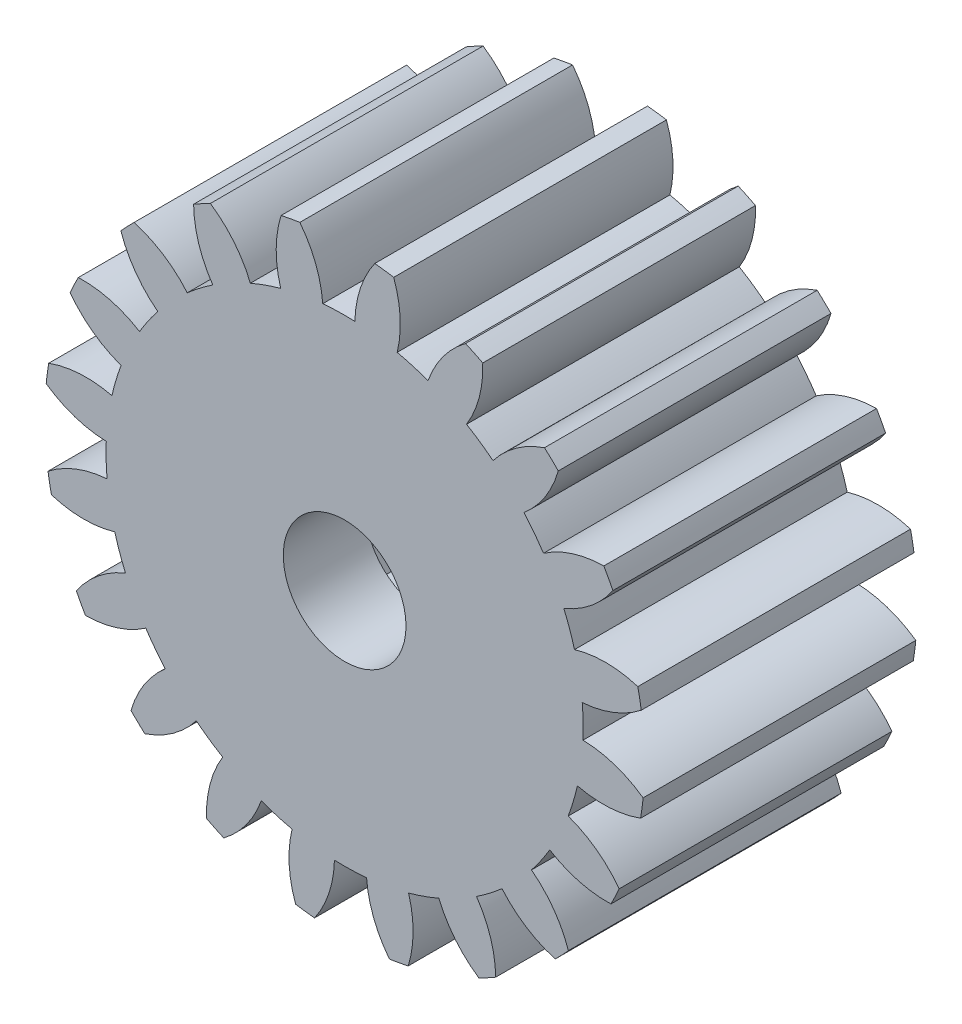
from build123d import *

# Parameters (mm, degrees)
SKETCH1_R           = 2.25
BOSS_EXTRUDE1_DEPTH = 10
CUT_EXTRUDE1_DEPTH  = 7


with BuildPart() as part:
    # Sketch1 → Boss-Extrude1 (new body)
    with BuildSketch(Plane.XY):
        with BuildLine():
            ThreePointArc((-30.571614903, -61.443860954), (-29.524113514, -61.972609686), (-28.368252904, -62.174650848))
            ThreePointArc((-28.368252904, -62.174650848), (-28.373609105, -62.764315084), (-28.339231944, -63.353000748))
            ThreePointArc((-28.339231944, -63.353000748), (-29.483745303, -63.611696612), (-30.503947952, -64.19136974))
            ThreePointArc((-30.503947952, -64.19136974), (-30.446172213, -64.536660067), (-30.377437772, -64.879936957))
            ThreePointArc((-30.377437772, -64.879936957), (-29.217812407, -65.059111153), (-28.056089489, -64.894083145))
            ThreePointArc((-28.056089489, -64.894083145), (-27.878967269, -65.456542317), (-27.664358771, -66.005792526))
            ThreePointArc((-27.664358771, -66.005792526), (-28.672914241, -66.605500992), (-29.464055771, -67.472062854))
            ThreePointArc((-29.464055771, -67.472062854), (-29.302407199, -67.782599785), (-29.130958468, -68.087835397))
            ThreePointArc((-29.130958468, -68.087835397), (-27.972721336, -67.899896238), (-26.918853644, -67.383953152))
            ThreePointArc((-26.918853644, -67.383953152), (-26.57659096, -67.864149836), (-26.202758501, -68.320200154))
            ThreePointArc((-26.202758501, -68.320200154), (-26.976631645, -69.202217578), (-27.46126961, -70.270843062))
            ThreePointArc((-27.46126961, -70.270843062), (-27.211571493, -70.516229077), (-26.954191069, -70.753544823))
            ThreePointArc((-26.954191069, -70.753544823), (-25.910718491, -70.216889105), (-25.067865938, -69.400535044))
            ThreePointArc((-25.067865938, -69.400535044), (-24.593965845, -69.751464244), (-24.09750275, -70.069673287))
            ThreePointArc((-24.09750275, -70.069673287), (-24.560941474, -71.147661659), (-24.691636133, -72.313746256))
            ThreePointArc((-24.691636133, -72.313746256), (-24.378330663, -72.469961264), (-24.060212735, -72.616127025))
            ThreePointArc((-24.060212735, -72.616127025), (-23.233647078, -71.783286348), (-22.684313942, -70.746431736))
            ThreePointArc((-22.684313942, -70.746431736), (-22.125165085, -70.933742055), (-21.554668621, -71.082961306))
            ThreePointArc((-21.554668621, -71.082961306), (-21.662308312, -72.251399614), (-21.426266363, -73.400798839))
            ThreePointArc((-21.426266363, -73.400798839), (-21.080022062, -73.452551425), (-20.732306229, -73.493259479))
            ThreePointArc((-20.732306229, -73.493259479), (-20.203557497, -72.44575809), (-20.001516335, -71.289897481))
            ThreePointArc((-20.001516335, -71.289897481), (-19.411852099, -71.295253682), (-18.823166434, -71.26087652))
            ThreePointArc((-18.823166434, -71.26087652), (-18.56447057, -72.40538988), (-17.984797442, -73.425592529))
            ThreePointArc((-17.984797442, -73.425592529), (-17.639507115, -73.36781679), (-17.296230226, -73.299082349))
            ThreePointArc((-17.296230226, -73.299082349), (-17.11705603, -72.139456983), (-17.282084037, -70.977734066))
            ThreePointArc((-17.282084037, -70.977734066), (-16.719624866, -70.800611845), (-16.170374656, -70.586003347))
            ThreePointArc((-16.170374656, -70.586003347), (-15.57066619, -71.594558818), (-14.704104328, -72.385700347))
            ThreePointArc((-14.704104328, -72.385700347), (-14.393567398, -72.224051775), (-14.088331786, -72.052603044))
            ThreePointArc((-14.088331786, -72.052603044), (-14.276270944, -70.894365913), (-14.79221403, -69.840498221))
            ThreePointArc((-14.79221403, -69.840498221), (-14.312017346, -69.498235536), (-13.855967028, -69.124403077))
            ThreePointArc((-13.855967028, -69.124403077), (-12.973949604, -69.898276222), (-11.905324121, -70.382914186))
            ThreePointArc((-11.905324121, -70.382914186), (-11.659938105, -70.13321607), (-11.422622359, -69.875835646))
            ThreePointArc((-11.422622359, -69.875835646), (-11.959278077, -68.832363068), (-12.775632138, -67.989510514))
            ThreePointArc((-12.775632138, -67.989510514), (-12.424702939, -67.515610422), (-12.106493895, -67.019147327))
            ThreePointArc((-12.106493895, -67.019147327), (-11.028505523, -67.48258605), (-9.862420926, -67.61328071))
            ThreePointArc((-9.862420926, -67.61328071), (-9.706205919, -67.29997524), (-9.560040157, -66.981857312))
            ThreePointArc((-9.560040157, -66.981857312), (-10.392880835, -66.155291654), (-11.429735447, -65.605958519))
            ThreePointArc((-11.429735447, -65.605958519), (-11.242425127, -65.046809661), (-11.093205876, -64.476313197))
            ThreePointArc((-11.093205876, -64.476313197), (-9.924767569, -64.583952889), (-8.775368344, -64.347910939))
            ThreePointArc((-8.775368344, -64.347910939), (-8.723615758, -64.001666638), (-8.682907704, -63.653950805))
            ThreePointArc((-8.682907704, -63.653950805), (-9.730409092, -63.125202073), (-10.886269702, -62.923160911))
            ThreePointArc((-10.886269702, -62.923160911), (-10.880913501, -62.333496675), (-10.915290662, -61.744811011))
            ThreePointArc((-10.915290662, -61.744811011), (-9.770777303, -61.486115147), (-8.750574654, -60.906442019))
            ThreePointArc((-8.750574654, -60.906442019), (-8.808350393, -60.561151691), (-8.877084834, -60.217874802))
            ThreePointArc((-8.877084834, -60.217874802), (-10.036710199, -60.038700606), (-11.198433117, -60.203728614))
            ThreePointArc((-11.198433117, -60.203728614), (-11.375555337, -59.641269442), (-11.590163835, -59.092019232))
            ThreePointArc((-11.590163835, -59.092019232), (-10.581608365, -58.492310767), (-9.790466835, -57.625748905))
            ThreePointArc((-9.790466835, -57.625748905), (-9.952115407, -57.315211974), (-10.123564138, -57.009976362))
            ThreePointArc((-10.123564138, -57.009976362), (-11.28180127, -57.19791552), (-12.335668962, -57.713858607))
            ThreePointArc((-12.335668962, -57.713858607), (-12.677931646, -57.233661923), (-13.051764106, -56.777611605))
            ThreePointArc((-13.051764106, -56.777611605), (-12.277890961, -55.89559418), (-11.793252996, -54.826968697))
            ThreePointArc((-11.793252996, -54.826968697), (-12.042951113, -54.581582682), (-12.300331537, -54.344266935))
            ThreePointArc((-12.300331537, -54.344266935), (-13.343804115, -54.880922654), (-14.186656669, -55.697276715))
            ThreePointArc((-14.186656669, -55.697276715), (-14.660556761, -55.346347515), (-15.157019856, -55.028138471))
            ThreePointArc((-15.157019856, -55.028138471), (-14.693581132, -53.9501501), (-14.562886473, -52.784065503))
            ThreePointArc((-14.562886473, -52.784065503), (-14.876191943, -52.627850495), (-15.194309871, -52.481684734))
            ThreePointArc((-15.194309871, -52.481684734), (-16.020875528, -53.314525411), (-16.570208664, -54.351380023))
            ThreePointArc((-16.570208664, -54.351380023), (-17.129357521, -54.164069704), (-17.699853985, -54.014850452))
            ThreePointArc((-17.699853985, -54.014850452), (-17.592214294, -52.846412145), (-17.828256244, -51.69701292))
            ThreePointArc((-17.828256244, -51.69701292), (-18.174500544, -51.645260334), (-18.522216377, -51.60455228))
            ThreePointArc((-18.522216377, -51.60455228), (-19.050965109, -52.652053668), (-19.253006271, -53.807914278))
            ThreePointArc((-19.253006271, -53.807914278), (-19.842670508, -53.802558077), (-20.431356172, -53.836935239))
            ThreePointArc((-20.431356172, -53.836935239), (-20.690052036, -52.692421879), (-21.269725164, -51.67221923))
            ThreePointArc((-21.269725164, -51.67221923), (-21.615015491, -51.729994969), (-21.95829238, -51.79872941))
            ThreePointArc((-21.95829238, -51.79872941), (-22.137466577, -52.958354776), (-21.972438569, -54.120077693))
            ThreePointArc((-21.972438569, -54.120077693), (-22.53489774, -54.297199913), (-23.08414795, -54.511808411))
            ThreePointArc((-23.08414795, -54.511808411), (-23.683856416, -53.503252941), (-24.550418278, -52.712111412))
            ThreePointArc((-24.550418278, -52.712111412), (-24.860955208, -52.873759984), (-25.16619082, -53.045208714))
            ThreePointArc((-25.16619082, -53.045208714), (-24.978251662, -54.203445846), (-24.462308576, -55.257313538))
            ThreePointArc((-24.462308576, -55.257313538), (-24.94250526, -55.599576222), (-25.398555578, -55.973408682))
            ThreePointArc((-25.398555578, -55.973408682), (-26.280573002, -55.199535537), (-27.349198485, -54.714897573))
            ThreePointArc((-27.349198485, -54.714897573), (-27.594584501, -54.964595689), (-27.831900247, -55.221976113))
            ThreePointArc((-27.831900247, -55.221976113), (-27.295244529, -56.265448691), (-26.478890468, -57.108301245))
            ThreePointArc((-26.478890468, -57.108301245), (-26.829819667, -57.582201337), (-27.148028711, -58.078664432))
            ThreePointArc((-27.148028711, -58.078664432), (-28.226017083, -57.615225709), (-29.39210168, -57.484531049))
            ThreePointArc((-29.39210168, -57.484531049), (-29.548316687, -57.797836519), (-29.694482449, -58.115954447))
            ThreePointArc((-29.694482449, -58.115954447), (-28.861641771, -58.942520105), (-27.824787159, -59.49185324))
            ThreePointArc((-27.824787159, -59.49185324), (-28.012097479, -60.051002097), (-28.16131673, -60.621498562))
            ThreePointArc((-28.16131673, -60.621498562), (-29.329755037, -60.51385887), (-30.479154262, -60.74990082))
            ThreePointArc((-30.479154262, -60.74990082), (-30.530906848, -61.096145121), (-30.571614903, -61.443860954))
        make_face()
        with Locations((-19.627261303, -62.548905879)):
            Circle(SKETCH1_R, mode=Mode.SUBTRACT)
    extrude(amount=-BOSS_EXTRUDE1_DEPTH)

    # Sketch2 → Cut-Extrude1 (cut)
    with BuildSketch(Plane(origin=(0, 0, -10), x_dir=(-1, 0, 0), z_dir=(0, 0, -1))):
        Polygon((24.400288017, -67.570680067), (17.664790642, -69.19335536), (12.891763928, -64.171581173), (14.854234589, -57.527131692), (21.589731964, -55.904456399), (26.362758678, -60.926230586), align=None)
    extrude(amount=-CUT_EXTRUDE1_DEPTH, mode=Mode.SUBTRACT)


solid = part.part
